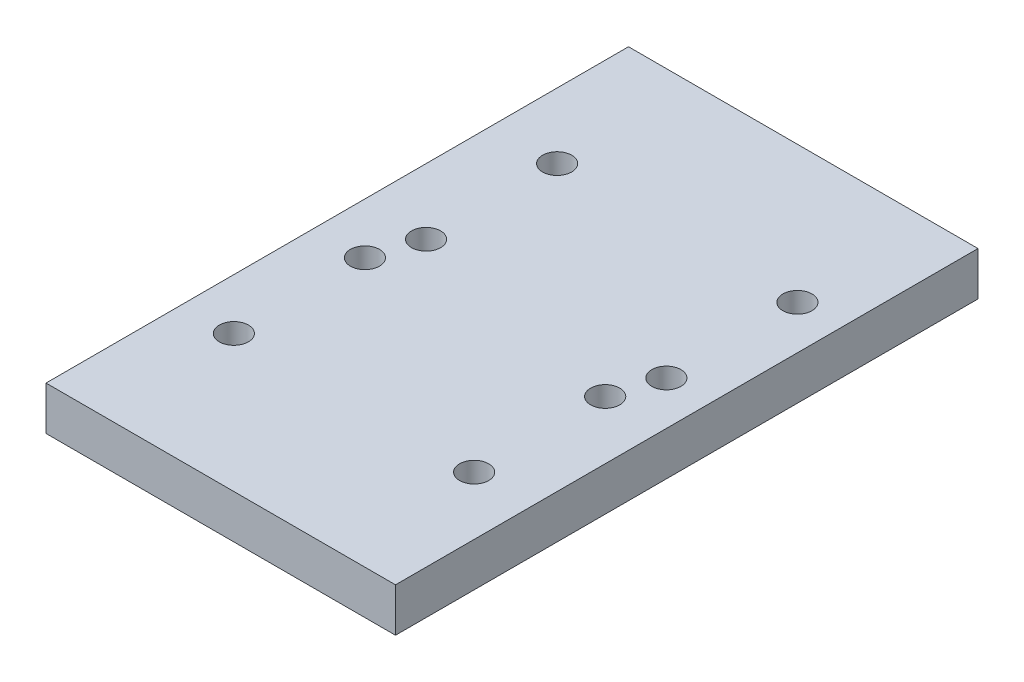
from build123d import *

# Parameters (mm, degrees)
CROQUIS1_W              = 48
CROQUIS1_H              = 6
SALIENTE_EXTRUIR1_DEPTH = 80
CROQUIS6_R              = 2
CORTAR_EXTRUIR4_DEPTH   = 84.737685662


with BuildPart() as part:
    # Croquis1 → Saliente-Extruir1 (new body)
    with BuildSketch(Plane.XY):
        Rectangle(CROQUIS1_W, CROQUIS1_H)
    extrude(amount=SALIENTE_EXTRUIR1_DEPTH)

    # Croquis6 → Cortar-Extruir4 (cut, through all)
    with BuildSketch(Plane.XZ.offset(3)):
        with Locations(Location((16, 61.2, 0), (0, 0, 270))):
            Circle(CROQUIS6_R)
        with Locations(Location((18, 36.8, 0), (0, 0, 270))):
            Circle(CROQUIS6_R)
        with Locations(Location((18, 18.8, 0), (0, 0, 270))):
            Circle(CROQUIS6_R)
        with Locations(Location((-17, 61.2, 0), (0, 0, 270))):
            Circle(CROQUIS6_R)
        with Locations(Location((-15, 36.8, 0), (0, 0, 270))):
            Circle(CROQUIS6_R)
        with Locations(Location((-15, 18.8, 0), (0, 0, 270))):
            Circle(CROQUIS6_R)
        with Locations(Location((-17, 43.2, 0), (0, 0, 270))):
            Circle(CROQUIS6_R)
        with Locations(Location((16, 43.2, 0), (0, 0, 270))):
            Circle(CROQUIS6_R)
    extrude(amount=-CORTAR_EXTRUIR4_DEPTH, mode=Mode.SUBTRACT)


solid = part.part
